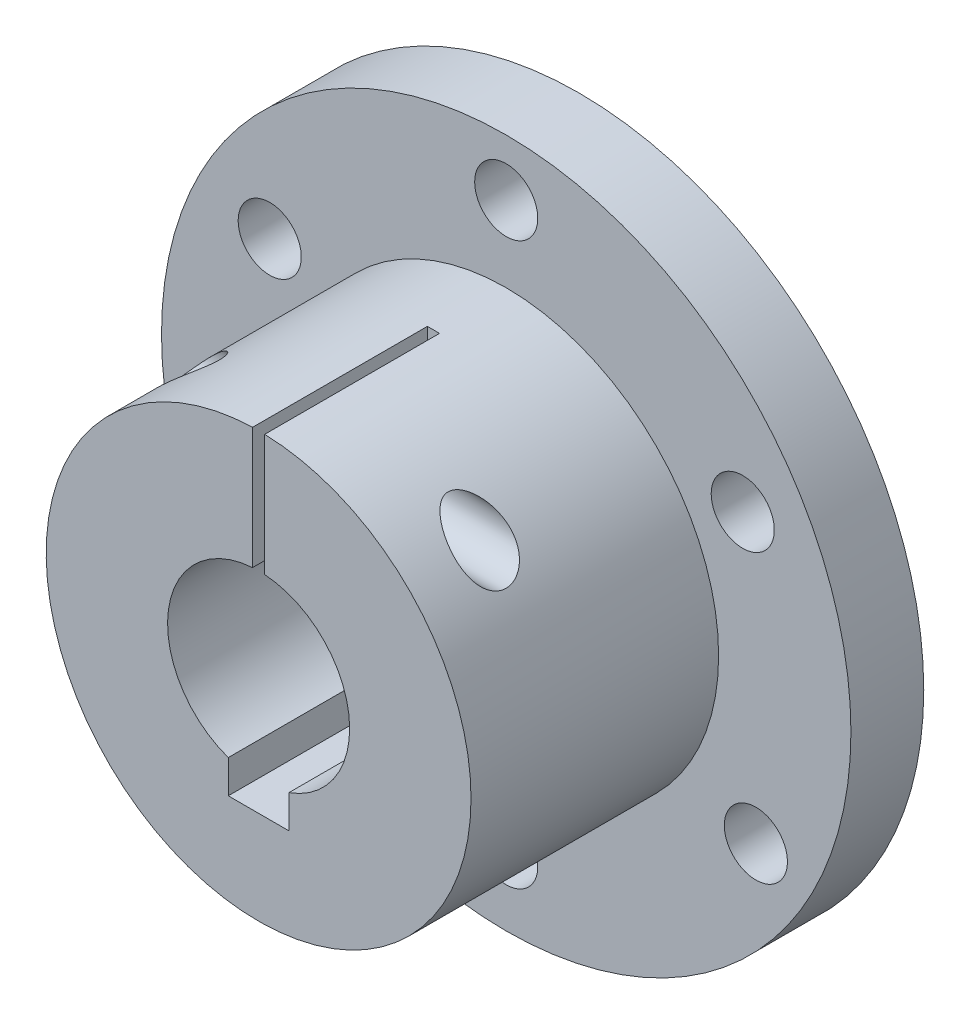
from build123d import *

# Parameters (mm, degrees)
SKETCH_2_R               = 2.6
CUT_EXTRUDE_1_DEPTH      = 49.063291606
SKETCH_3_W               = 5
SKETCH_3_H               = 3.3
CUT_EXTRUDE_2_DEPTH      = 49.063291606
CUT_EXTRUDE_START        = 12
SKETCH_4_W               = 1
SKETCH_4_H               = 11
CUT_EXTRUDE_3_DEPTH      = 14.4
CUT_EXTRUDE_4_DEPTH      = 49.063291606
CUT_EXTRUDE_4_DEPTH_BACK = 49.063291606
SKETCH_5_R               = 2.25


with BuildPart() as part:
    # 草图1 → 旋转1 (revolve)
    with BuildSketch(Plane(origin=(0, 0, 0), x_dir=(0, 0, -1), z_dir=(1, 0, 0)), mode=Mode.PRIVATE) as revolve_1_sk:
        Polygon((0, 7.5), (0, 28.4), (-6, 28.4), (-6, 17.5), (-26.4, 17.5), (-26.4, 7.5), align=None)
    revolve(revolve_1_sk.sketch.rotate(Axis((0, 0, 31.4), (0, 0, -1)), 90), axis=Axis((0, 0, 31.4), (0, 0, -1)))

    # 草图2 → 切除-拉伸1 (cut, through all)
    with BuildSketch(Plane.XY):
        with Locations(Location((0, 23.75, 0), (0, 0, 180))):
            Circle(SKETCH_2_R)
        with Locations(Location((-20.56810334, -11.875, 0), (0, 0, 180))):
            Circle(SKETCH_2_R)
        with Locations(Location((20.56810334, -11.875, 0), (0, 0, 180))):
            Circle(SKETCH_2_R)
        with Locations(Location((19.485571585, 11.25, 0), (0, 0, 180))):
            Circle(SKETCH_2_R)
        with Locations(Location((-19.485571585, 11.25, 0), (0, 0, 180))):
            Circle(SKETCH_2_R)
        with Locations(Location((0, -22.5, 0), (0, 0, 180))):
            Circle(SKETCH_2_R)
    extrude(amount=CUT_EXTRUDE_1_DEPTH, mode=Mode.SUBTRACT)

    # 草图3 → 切除-拉伸2 (cut, through all)
    with BuildSketch(Plane.XY):
        with Locations((0, -8.15)):
            Rectangle(SKETCH_3_W, SKETCH_3_H)
    extrude(amount=CUT_EXTRUDE_2_DEPTH, mode=Mode.SUBTRACT)

    # 草图4 → 切除-拉伸3 (cut)
    with BuildSketch(Plane.XY.offset(CUT_EXTRUDE_START)):
        with Locations((0, 12.5)):
            Rectangle(SKETCH_4_W, SKETCH_4_H)
    extrude(amount=CUT_EXTRUDE_3_DEPTH, mode=Mode.SUBTRACT)

    # 草图5 → 切除-拉伸4 (cut, two sides: drawn at the far end of the back side and taken through both)
    with BuildSketch(Plane(origin=(0, 0, 0), x_dir=(0, 0, -1), z_dir=(1, 0, 0)).offset(-CUT_EXTRUDE_4_DEPTH_BACK)):
        with Locations((-20.2, 12.5)):
            Circle(SKETCH_5_R)
    extrude(amount=CUT_EXTRUDE_4_DEPTH + CUT_EXTRUDE_4_DEPTH_BACK, mode=Mode.SUBTRACT)


solid = part.part
